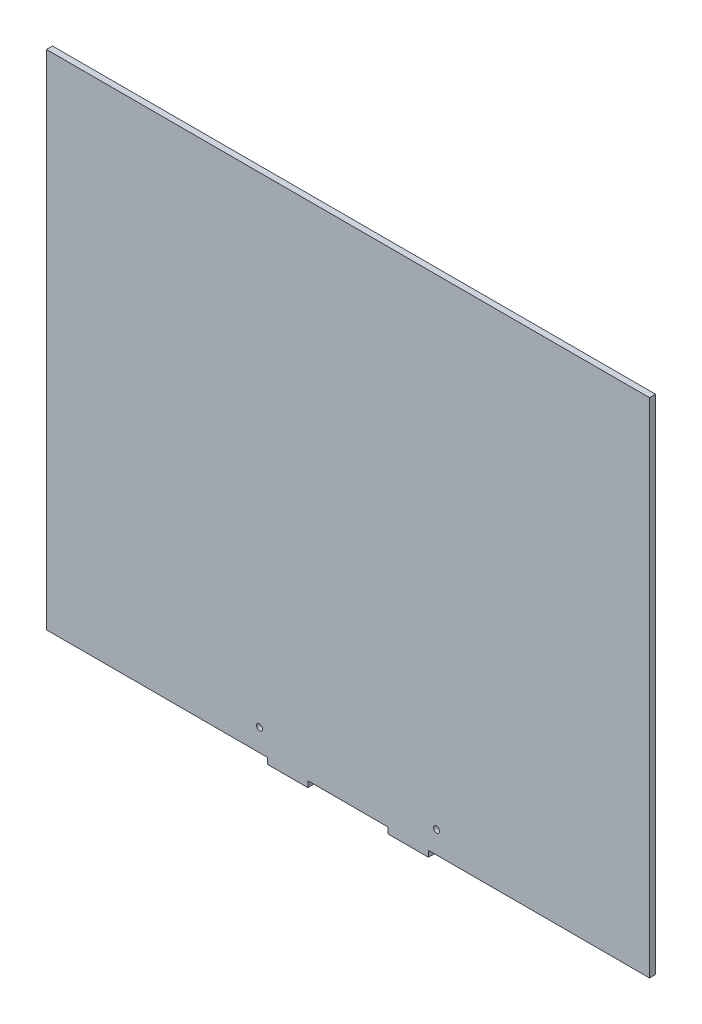
from build123d import *

# Parameters (mm, degrees)
RESSALTO_EXTRUS_O1_DEPTH = 3
ESBO_O3_R                = 1.5
CORTE_EXTRUS_O2_DEPTH    = 232.600745995


with BuildPart() as part:
    # Esboço1 → Ressalto-extrusão1 (new body)
    with BuildSketch(Plane.XY):
        Polygon((-182.836591611, -107.870881543), (-72.836591611, -107.870881543), (-72.836591611, -110.870881543), (-52.836591611, -110.870881543), (-52.836591611, -107.870881543), (-12.836591611, -107.870881543), (-12.836591611, -110.870881543), (7.163408389, -110.870881543), (7.163408389, -107.870881543), (117.163408389, -107.870881543), (117.163408389, 142.129118457), (-182.836591611, 142.129118457), align=None)
    extrude(amount=RESSALTO_EXTRUS_O1_DEPTH)

    # Esboço3 → Corte-extrusão2 (cut, through all)
    with BuildSketch(Plane(origin=(0, 0, 0), x_dir=(-1, 0, 0), z_dir=(0, 0, -1))):
        with Locations((-11.163408389, -96.870881543)):
            Circle(ESBO_O3_R)
        with Locations((76.836591611, -96.870881543)):
            Circle(ESBO_O3_R)
    extrude(amount=-CORTE_EXTRUS_O2_DEPTH, mode=Mode.SUBTRACT)


solid = part.part
